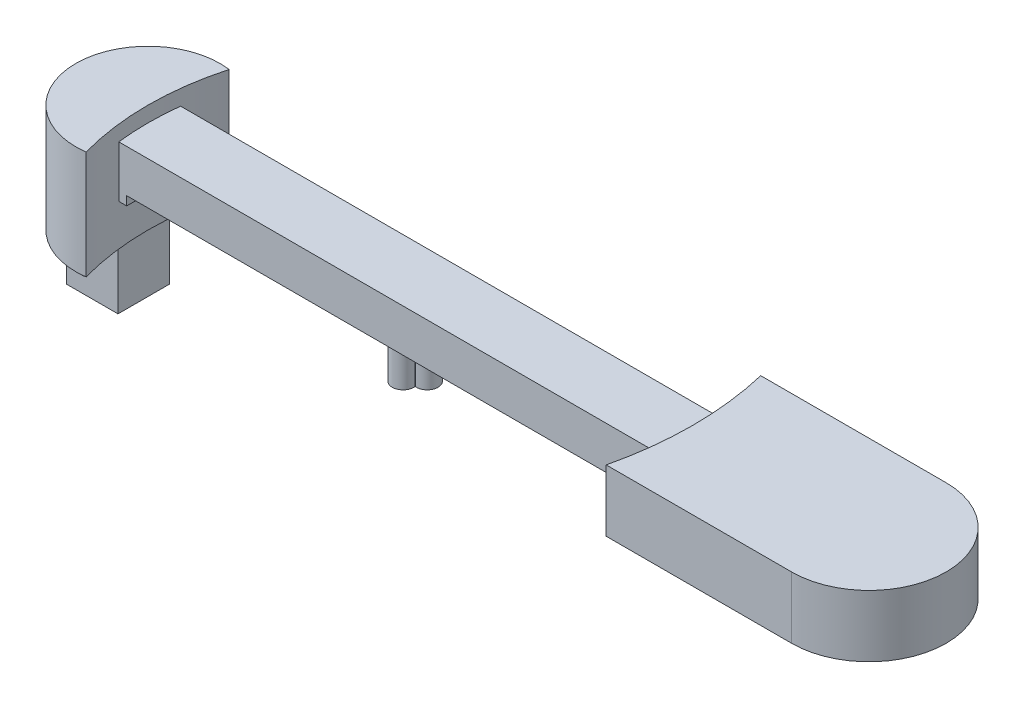
from build123d import *

# Parameters (mm, degrees)
BOSS_EXTRUDE1_DEPTH      = 32.5
BOSS_EXTRUDE1_DEPTH_BACK = 20
BOSS_EXTRUDE2_DEPTH      = 30
BOSS_EXTRUDE4_DEPTH      = 25
SKETCH2_W                = 25
SKETCH2_H                = 25
BOSS_EXTRUDE5_DEPTH      = 30
CUT_EXTRUDE1_DEPTH       = 304.293772711
CUT_EXTRUDE1_DEPTH_BACK  = 304.293772711
SKETCH3_R                = 2.5
SKETCH4_W                = 1
SKETCH4_H                = 30
BOSS_EXTRUDE6_DEPTH      = 15
CUT_EXTRUDE2_DEPTH       = 2
CUT_EXTRUDE2_DEPTH_BACK  = 5
SKETCH5_W                = 24.298824304
SKETCH5_H                = 9.719529722
CUT_EXTRUDE3_REACH       = 305.716
SKETCH6_W                = 258.900724606
SKETCH6_H                = 4.300489871
BOSS_EXTRUDE7_DEPTH      = 20


with BuildPart() as part:
    # Sketch1 → Boss-Extrude1 (new, two sides: drawn at the far end of the back side and taken through both)
    with BuildSketch(Plane(origin=(0, 0, 0), x_dir=(1, 0, 0), z_dir=(0, 1, 0)).offset(-BOSS_EXTRUDE1_DEPTH_BACK)):
        with BuildLine():
            ThreePointArc((-255.2, -34.7), (-259.916681078, 0), (-255.2, 34.7))
            ThreePointArc((-255.2, 34.7), (-294.935777018, 0), (-255.2, -34.7))
        make_face()
    extrude(amount=BOSS_EXTRUDE1_DEPTH + BOSS_EXTRUDE1_DEPTH_BACK)



with BuildPart() as body_2:
    # Sketch1<3> → Boss-Extrude2 (new body)
    with BuildSketch(Plane(origin=(0, 0, 0), x_dir=(1, 0, 0), z_dir=(0, 1, 0))):
        with BuildLine():
            ThreePointArc((0, -37.5), (4.396048304, 0), (0, 37.5))
            Line((0, 37.5), (90, 37.5))
            ThreePointArc((90, 37.5), (127.5, 0), (90, -37.5))
            Line((90, -37.5), (0, -37.5))
        make_face()
    extrude(amount=BOSS_EXTRUDE2_DEPTH)


with BuildPart() as part_1:
    add(part.part)

    add(body_2.part)  # Boss-Extrude4 merges body 2
    # Sketch1<5> → Boss-Extrude4 (add)
    with BuildSketch(Plane(origin=(0, 0, 0), x_dir=(1, 0, 0), z_dir=(0, 1, 0))):
        with BuildLine():
            ThreePointArc((3.700724606, -15), (4.396048304, 0), (3.700724606, 15))
            Line((3.700724606, 15), (-259.04839678, 15))
            ThreePointArc((-259.04839678, 15), (-259.916681078, 0), (-259.04839678, -15))
            Line((-259.04839678, -15), (3.700724606, -15))
        make_face()
    extrude(amount=BOSS_EXTRUDE4_DEPTH)

    # Sketch2 → Boss-Extrude5 (add)
    with BuildSketch(Plane.XZ.offset(20)):
        with Locations((-274.43065957, 0)):
            Rectangle(SKETCH2_W, SKETCH2_H)
    extrude(amount=BOSS_EXTRUDE5_DEPTH)

    # Sketch3 → Cut-Extrude1 (cut, two sides: drawn at the far end of the back side and taken through both)
    with BuildSketch(Plane.XY.offset(12.5).offset(-CUT_EXTRUDE1_DEPTH_BACK)):
        with Locations((-279.13065957, -40)):
            Circle(SKETCH3_R)
    extrude(amount=CUT_EXTRUDE1_DEPTH + CUT_EXTRUDE1_DEPTH_BACK, mode=Mode.SUBTRACT)

    # Sketch4 → Boss-Extrude6 (add)
    with BuildSketch(Plane.XZ):
        with Locations((90, 0)):
            Rectangle(SKETCH4_W, SKETCH4_H)
    extrude(amount=BOSS_EXTRUDE6_DEPTH)

    # Sketch5 → Cut-Extrude2 (cut, two sides: drawn at the far end of the back side and taken through both)
    with BuildSketch(Plane(origin=(90.5, 0, 0), x_dir=(0, 0, -1), z_dir=(1, 0, 0)).offset(-CUT_EXTRUDE2_DEPTH_BACK)):
        with Locations((0, -6.741495989)):
            Rectangle(SKETCH5_W, SKETCH5_H)
    extrude(amount=CUT_EXTRUDE2_DEPTH + CUT_EXTRUDE2_DEPTH_BACK, mode=Mode.SUBTRACT)

    # Cut-Extrude3: up to this face of the body (flat: up to its plane)
    cut_extrude3_end = Plane(part_1.part.faces().sort_by_distance((-127.673836087, 12.5, -15))[0])
    # Sketch6 → Cut-Extrude3 (cut, up to the picked face)
    with BuildSketch(Plane.XY.offset(15), mode=Mode.PRIVATE) as cut_extrude3_sk1:
        with Locations((-125.749637697, 2.150244935)):
            Rectangle(SKETCH6_W, SKETCH6_H)
    cut_extrude3_tool1 = split(extrude(cut_extrude3_sk1.sketch, amount=-CUT_EXTRUDE3_REACH, mode=Mode.PRIVATE), bisect_by=cut_extrude3_end, keep=Keep.BOTH, mode=Mode.PRIVATE)
    add(cut_extrude3_tool1.solids().sort_by(Axis((-125.749638, 2.150245, 15), (0, 0, -1)))[0], mode=Mode.SUBTRACT)

    # Sketch7 → Boss-Extrude7 (add)
    with BuildSketch(Plane.XZ.offset(-4.300489871)):
        with BuildLine():
            ThreePointArc((-124.971686685, -5.377242777), (-124.896699141, -5.303300859), (-124.822757223, -5.228313315))
            ThreePointArc((-124.822757223, -5.228313315), (-119.096060376, 0), (-124.822757223, 5.228313315))
            ThreePointArc((-124.822757223, 5.228313315), (-124.896699141, 5.303300859), (-124.971686685, 5.377242777))
            ThreePointArc((-124.971686685, 5.377242777), (-130.2, 11.103939624), (-135.428313315, 5.377242777))
            ThreePointArc((-135.428313315, 5.377242777), (-135.503300859, 5.303300859), (-135.577242777, 5.228313315))
            ThreePointArc((-135.577242777, 5.228313315), (-141.303939624, 0), (-135.577242777, -5.228313315))
            ThreePointArc((-135.577242777, -5.228313315), (-135.503300859, -5.303300859), (-135.428313315, -5.377242777))
            ThreePointArc((-135.428313315, -5.377242777), (-130.2, -11.103939624), (-124.971686685, -5.377242777))
        make_face()
        with BuildLine():
            Line((-132.7, 7.071067812), (-132.7, -7.071067812))
            ThreePointArc((-132.7, -7.071067812), (-130.2, -7.5), (-127.7, -7.071067812))
            Line((-127.7, -7.071067812), (-127.7, 7.071067812))
            ThreePointArc((-127.7, 7.071067812), (-130.2, 7.5), (-132.7, 7.071067812))
        make_face(mode=Mode.SUBTRACT)
    extrude(amount=BOSS_EXTRUDE7_DEPTH)


solid = part_1.part
